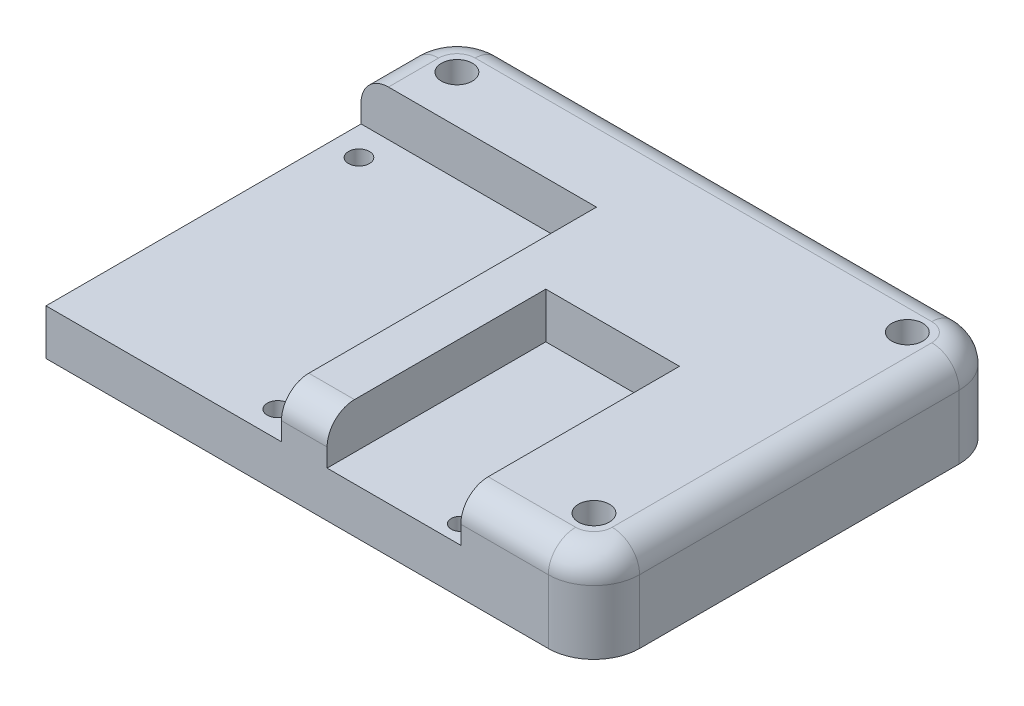
from build123d import *

# Parameters (mm, degrees)
SKETCH1_W           = 60
SKETCH1_H           = 45
BOSS_EXTRUDE1_DEPTH = 10
SKETCH2_W           = 25.78
SKETCH2_H           = 34.5
CUT_EXTRUDE1_DEPTH  = 5
CUT_EXTRUDE2_REACH  = 48.312
SKETCH3_R           = 1.15
SKETCH4_W           = 14.64
SKETCH4_H           = 23.95
CUT_EXTRUDE3_DEPTH  = 5
CUT_EXTRUDE4_REACH  = 48.312
SKETCH5_R           = 1.015
FILLET1_R           = 5
FILLET2_R           = 5
FILLET3_R           = 5
FILLET4_R           = 3
CUT_EXTRUDE5_REACH  = 49.115
SKETCH6_R           = 1.7


with BuildPart() as part:
    # Sketch1 → Boss-Extrude1 (new body)
    with BuildSketch(Plane(origin=(0, 0, 0), x_dir=(1, 0, 0), z_dir=(0, 1, 0))):
        with Locations((-9.130434783, -1.760869565)):
            Rectangle(SKETCH1_W, SKETCH1_H)
    extrude(amount=BOSS_EXTRUDE1_DEPTH)

    # Sketch2 → Cut-Extrude1 (cut)
    with BuildSketch(Plane(origin=(0, 10, 0), x_dir=(1, 0, 0), z_dir=(0, 1, 0))):
        with Locations((-26.240434783, -7.010869565)):
            Rectangle(SKETCH2_W, SKETCH2_H)
    extrude(amount=-CUT_EXTRUDE1_DEPTH, mode=Mode.SUBTRACT)

    # Sketch3 → Cut-Extrude2 (cut, up to next)
    with BuildSketch(Plane(origin=(0, 5, 0), x_dir=(1, 0, 0), z_dir=(0, 1, 0)), mode=Mode.PRIVATE) as cut_extrude2_sk1:
        with Locations(Location((-36.060434783, 6.939130435, 0), (0, 0, 270))):
            Circle(SKETCH3_R)
    cut_extrude2_tool1 = extrude(cut_extrude2_sk1.sketch, amount=-CUT_EXTRUDE2_REACH, mode=Mode.PRIVATE) & part.part
    # Sketch3 → Cut-Extrude2 (cut, up to next)
    with BuildSketch(Plane(origin=(0, 5, 0), x_dir=(1, 0, 0), z_dir=(0, 1, 0)), mode=Mode.PRIVATE) as cut_extrude2_sk2:
        with Locations(Location((-16.640434783, -21.370869565, 0), (0, 0, 270))):
            Circle(SKETCH3_R)
    cut_extrude2_tool2 = extrude(cut_extrude2_sk2.sketch, amount=-CUT_EXTRUDE2_REACH, mode=Mode.PRIVATE) & part.part
    add(cut_extrude2_tool1.solids().sort_by_distance((-36.060435, 5, -6.93913))[0], mode=Mode.SUBTRACT)
    add(cut_extrude2_tool2.solids().sort_by_distance((-16.640435, 5, 21.37087))[0], mode=Mode.SUBTRACT)

    # Sketch4 → Cut-Extrude3 (cut)
    with BuildSketch(Plane(origin=(0, 10, 0), x_dir=(1, 0, 0), z_dir=(0, 1, 0))):
        with Locations((-1.030434783, -12.285869565)):
            Rectangle(SKETCH4_W, SKETCH4_H)
    extrude(amount=-CUT_EXTRUDE3_DEPTH, mode=Mode.SUBTRACT)

    # Sketch5 → Cut-Extrude4 (cut, up to next)
    with BuildSketch(Plane(origin=(0, 5, 0), x_dir=(1, 0, 0), z_dir=(0, 1, 0)), mode=Mode.PRIVATE) as cut_extrude4_sk1:
        with Locations(Location((4.244565217, -2.330869565, 0), (0, 0, 270))):
            Circle(SKETCH5_R)
    cut_extrude4_tool1 = extrude(cut_extrude4_sk1.sketch, amount=-CUT_EXTRUDE4_REACH, mode=Mode.PRIVATE) & part.part
    # Sketch5 → Cut-Extrude4 (cut, up to next)
    with BuildSketch(Plane(origin=(0, 5, 0), x_dir=(1, 0, 0), z_dir=(0, 1, 0)), mode=Mode.PRIVATE) as cut_extrude4_sk2:
        with Locations(Location((4.239565217, -22.245869565, 0), (0, 0, 270))):
            Circle(SKETCH5_R)
    cut_extrude4_tool2 = extrude(cut_extrude4_sk2.sketch, amount=-CUT_EXTRUDE4_REACH, mode=Mode.PRIVATE) & part.part
    add(cut_extrude4_tool1.solids().sort_by_distance((4.244565, 5, 2.33087))[0], mode=Mode.SUBTRACT)
    add(cut_extrude4_tool2.solids().sort_by_distance((4.239565, 5, 22.24587))[0], mode=Mode.SUBTRACT)

    # Fillet1
    fillet1_edges = [part.edges().sort_by_distance(p)[0] for p in [
        (-39.130434783, 5, -20.739130435),
    ]]
    fillet(fillet1_edges, radius=FILLET1_R)

    # Fillet2
    fillet2_edges = [part.edges().sort_by_distance(p)[0] for p in [
        (20.869565217, 5, -20.739130435),
    ]]
    fillet(fillet2_edges, radius=FILLET2_R)

    # Fillet3
    fillet3_edges = [part.edges().sort_by_distance(p)[0] for p in [
        (20.869565217, 5, 24.260869565),
    ]]
    fillet(fillet3_edges, radius=FILLET3_R)

    # Fillet4
    fillet4_edges = [part.edges().sort_by_distance(p)[0] for p in [
        (-10.850434783, 10, 24.260869565),
        (11.079565217, 10, 24.260869565),
        (-39.130434783, 10, -12.989130435),
        (-37.665968689, 10, -19.274664341),
        (-9.130434783, 10, -20.739130435),
        (19.405099123, 10, -19.274664341),
        (20.869565217, 10, 1.760869565),
        (19.405099123, 10, 22.796403471),
    ]]
    fillet(fillet4_edges, radius=FILLET4_R)

    # Sketch6 → Cut-Extrude5 (cut, up to next)
    with BuildSketch(Plane(origin=(0, 10, 0), x_dir=(1, 0, 0), z_dir=(0, 1, 0)), mode=Mode.PRIVATE) as cut_extrude5_sk1:
        with Locations(Location((-33.790434783, 15.395190435, 0), (0, 0, 270))):
            Circle(SKETCH6_R)
    cut_extrude5_tool1 = extrude(cut_extrude5_sk1.sketch, amount=-CUT_EXTRUDE5_REACH, mode=Mode.PRIVATE) & part.part
    # Sketch6 → Cut-Extrude5 (cut, up to next)
    with BuildSketch(Plane(origin=(0, 10, 0), x_dir=(1, 0, 0), z_dir=(0, 1, 0)), mode=Mode.PRIVATE) as cut_extrude5_sk2:
        with Locations(Location((15.529565217, 15.399130435, 0), (0, 0, 270))):
            Circle(SKETCH6_R)
    cut_extrude5_tool2 = extrude(cut_extrude5_sk2.sketch, amount=-CUT_EXTRUDE5_REACH, mode=Mode.PRIVATE) & part.part
    # Sketch6 → Cut-Extrude5 (cut, up to next)
    with BuildSketch(Plane(origin=(0, 10, 0), x_dir=(1, 0, 0), z_dir=(0, 1, 0)), mode=Mode.PRIVATE) as cut_extrude5_sk3:
        with Locations(Location((15.529565217, -18.920869565, 0), (0, 0, 270))):
            Circle(SKETCH6_R)
    cut_extrude5_tool3 = extrude(cut_extrude5_sk3.sketch, amount=-CUT_EXTRUDE5_REACH, mode=Mode.PRIVATE) & part.part
    add(cut_extrude5_tool1.solids().sort_by_distance((-33.790435, 10, -15.39519))[0], mode=Mode.SUBTRACT)
    add(cut_extrude5_tool2.solids().sort_by_distance((15.529565, 10, -15.39913))[0], mode=Mode.SUBTRACT)
    add(cut_extrude5_tool3.solids().sort_by_distance((15.529565, 10, 18.92087))[0], mode=Mode.SUBTRACT)


solid = part.part
